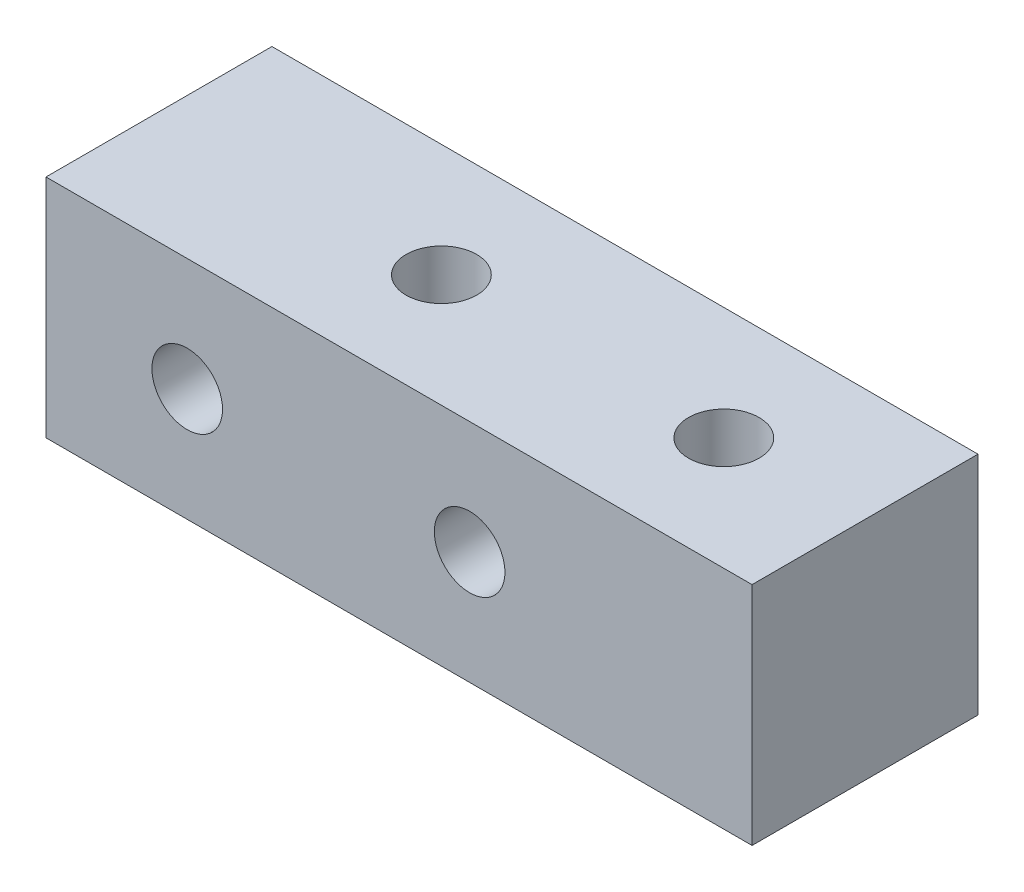
from build123d import *

# Parameters (mm, degrees)
SKETCH_1_W                   = 25
SKETCH_1_H                   = 8
EXTRUDE_1_DEPTH              = 8
HOLE_WIZARD_M3_1_D           = 2.5
HOLE_WIZARD_M3_1_ON_FACE_2_D = 2.5


with BuildPart() as part:
    # 草图1 → 凸台-拉伸1 (new body)
    with BuildSketch(Plane.XY):
        Rectangle(SKETCH_1_W, SKETCH_1_H)
    extrude(amount=EXTRUDE_1_DEPTH)

    # M3 螺纹孔的螺纹孔钻头1 (through all)
    with Locations(Plane(origin=(-2.5, 4, 4), x_dir=(1, 0, 0), z_dir=(0, 1, 0))):
        with Locations((0, 0), (10, 0)):
            Hole(HOLE_WIZARD_M3_1_D / 2)

    # M3 螺纹孔的螺纹孔钻头1 on face 2 (through all)
    with Locations(Plane(origin=(2.5, 0, 8), x_dir=(1, 0, 0), z_dir=(0, 0, 1))):
        with Locations((0, 0), (-10, 0)):
            Hole(HOLE_WIZARD_M3_1_ON_FACE_2_D / 2)


solid = part.part
